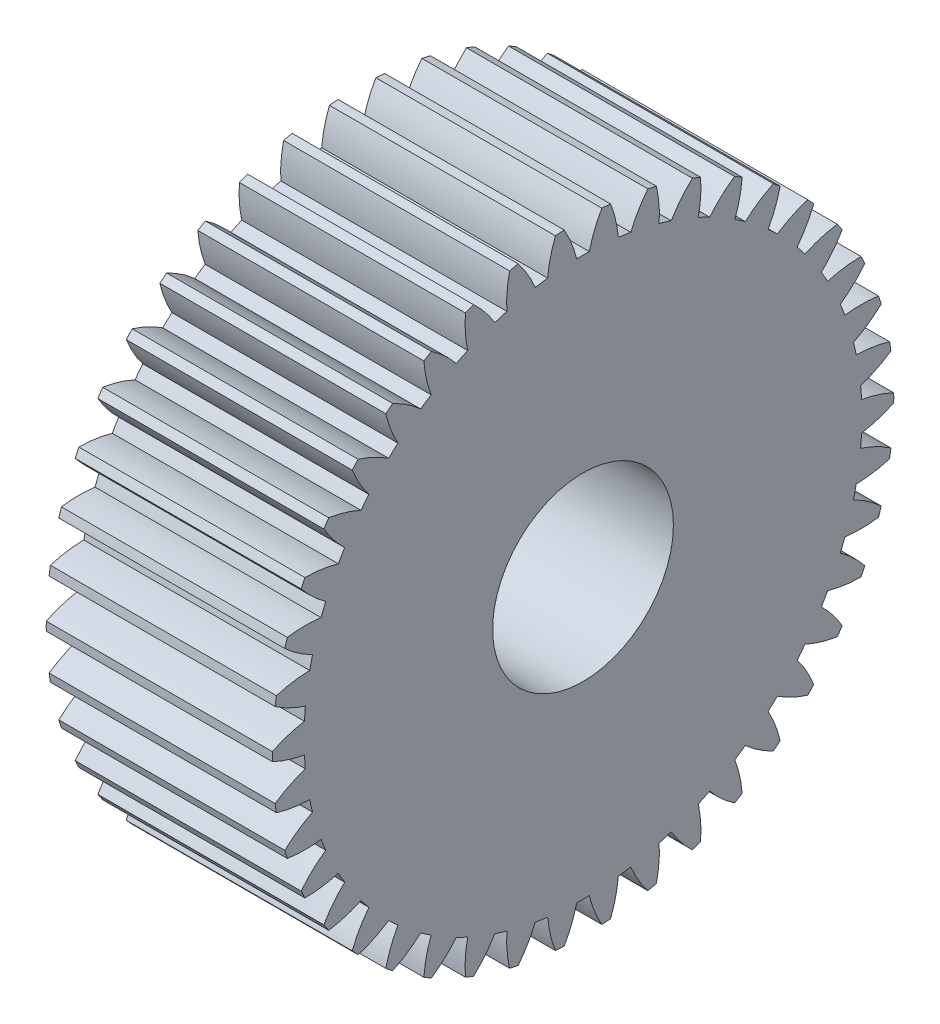
from build123d import *

# Parameters (mm, degrees)
BASPROSKE_W        = 8
BASPROSKE_H        = 11
TOOTHCUT_DEPTH     = 18.492855685
TEETHCUTS_COUNT    = 42
TEETHCUTS_ANGLE    = 351.428571429
BORSKE_R           = 1
BORE_DEPTH         = 50.0000508
SKETCH1_R          = 3.2
CUT_EXTRUDE1_DEPTH = 18.480126314
SKETCH2_R          = 3.55
CUT_EXTRUDE2_DEPTH = 3.1
CHAMFER1_SIZE      = 0.5


with BuildPart() as part:
    # BasProSke → Base-Revolve (revolve)
    with BuildSketch(Plane(origin=(0, 0, 0), x_dir=(1, 0, 0), z_dir=(0, 1, 0)), mode=Mode.PRIVATE) as base_revolve_sk:
        with Locations((4, 5.5)):
            Rectangle(BASPROSKE_W, BASPROSKE_H)
    revolve(base_revolve_sk.sketch.rotate(Axis((-10, 0, 0), (1, 0, 0)), 180), axis=Axis((-10, 0, 0), (1, 0, 0)))

    # TooCutSke → ToothCut (cut, through all)
    with BuildSketch(Plane(origin=(0, 0, 0), x_dir=(0, 0, -1), z_dir=(1, 0, 0))):
        with BuildLine():
            ThreePointArc((0.222918323, 9.871483345), (0, 9.874), (-0.222918323, 9.871483345))
            ThreePointArc((-0.222918323, 9.871483345), (-0.4107979, 10.454669903), (-0.681527943, 11.004315736))
            ThreePointArc((-0.681527943, 11.004315736), (0, 11.0254), (0.681527943, 11.004315736))
            ThreePointArc((0.681527943, 11.004315736), (0.4107979, 10.454669903), (0.222918323, 9.871483345))
        make_face()
    toothcut = extrude(amount=TOOTHCUT_DEPTH, mode=Mode.SUBTRACT)

    # TeethCuts: ToothCut ×42 about axis
    teethcuts_axis = Axis((-10, 0, 0), (1, 0, 0))
    for i in range(1, TEETHCUTS_COUNT):
        add(toothcut.rotate(teethcuts_axis, i * TEETHCUTS_ANGLE / (TEETHCUTS_COUNT - 1)), mode=Mode.SUBTRACT)

    # BorSke → Bore (cut, symmetric)
    with BuildSketch(Plane(origin=(0, 0, 0), x_dir=(0, 0, -1), z_dir=(1, 0, 0))):
        with Locations(Location((0, 0, 0), (0, 0, 180))):
            Circle(BORSKE_R)
    extrude(amount=BORE_DEPTH, both=True, mode=Mode.SUBTRACT)

    # Sketch1 → Cut-Extrude1 (cut, through all)
    with BuildSketch(Plane(origin=(8, 0, 0), x_dir=(0, 0, -1), z_dir=(1, 0, 0))):
        Circle(SKETCH1_R)
    extrude(amount=-CUT_EXTRUDE1_DEPTH, mode=Mode.SUBTRACT)

    # Sketch2 → Cut-Extrude2 (cut)
    with BuildSketch(Plane.ZY):
        Circle(SKETCH2_R)
    extrude(amount=-CUT_EXTRUDE2_DEPTH, mode=Mode.SUBTRACT)

    # Chamfer1
    chamfer1_edges = [part.edges().sort_by_distance(p)[0] for p in [
        (0, 0, -3.55),
    ]]
    chamfer(chamfer1_edges, length=CHAMFER1_SIZE)


solid = part.part
